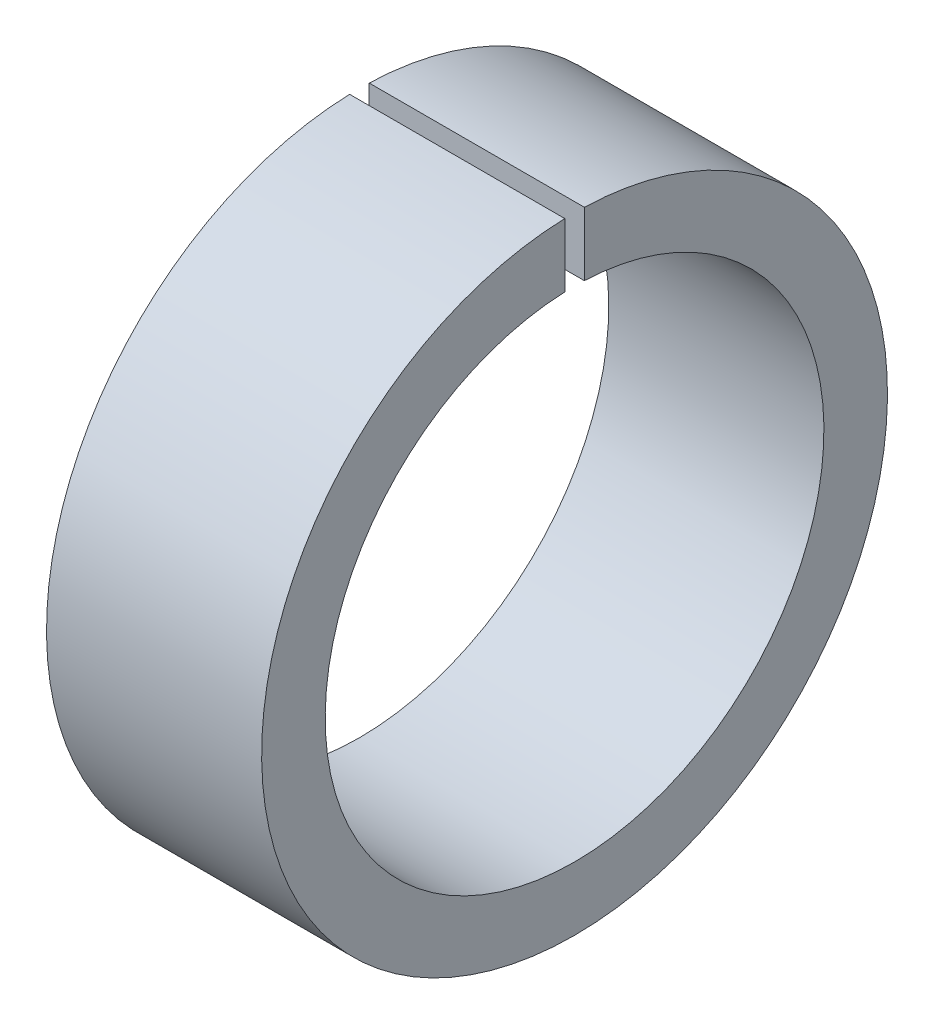
from build123d import *

# Parameters (mm, degrees)
SCHIZZO1_R                   = 16
SCHIZZO1_R_2                 = 12.75
ESTRUSIONE_ESTRUSIONE1_DEPTH = 11
SCHIZZO2_W                   = 1
SCHIZZO2_H                   = 19.267745515
TAGLIO_ESTRUSIONE1_DEPTH     = 26.159491251


with BuildPart() as part:
    # Schizzo1 → Estrusione-Estrusione1 (new body)
    with BuildSketch(Plane(origin=(0, 0, 0), x_dir=(0, 0, -1), z_dir=(1, 0, 0))):
        Circle(SCHIZZO1_R)
        Circle(SCHIZZO1_R_2, mode=Mode.SUBTRACT)
    extrude(amount=ESTRUSIONE_ESTRUSIONE1_DEPTH)

    # Schizzo2 → Taglio-Estrusione1 (cut, through all)
    with BuildSketch(Plane(origin=(11, 0, 0), x_dir=(0, 0, -1), z_dir=(1, 0, 0))):
        with Locations((0, 6.366127243)):
            Rectangle(SCHIZZO2_W, SCHIZZO2_H)
    extrude(amount=-TAGLIO_ESTRUSIONE1_DEPTH, mode=Mode.SUBTRACT)


solid = part.part
